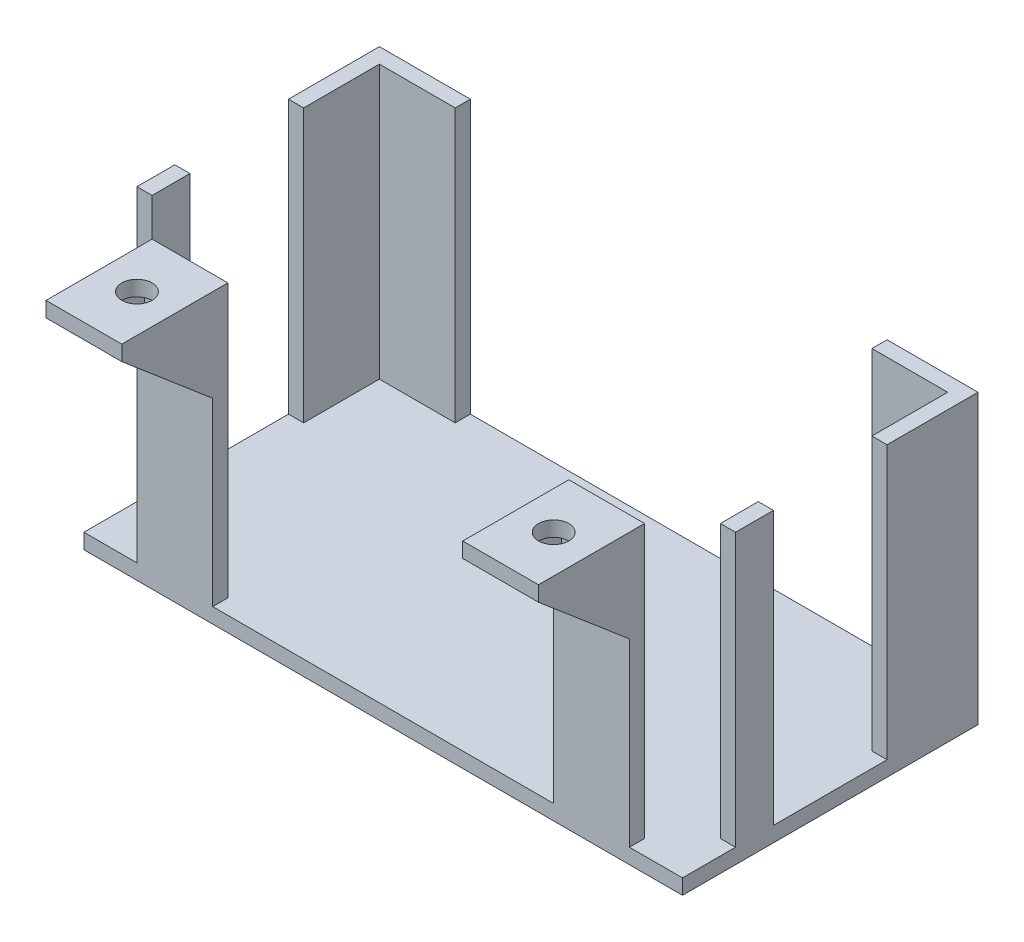
from build123d import *

# Parameters (mm, degrees)
CROQUIS1_W                = 5
CROQUIS1_H                = 2
SALIENTE_EXTRUIR1_DEPTH   = 36
CROQUIS1_W_2              = 2
CROQUIS1_H_2              = 5
SALIENTE_EXTRUIR1_2_DEPTH = 36
SALIENTE_EXTRUIR1_3_DEPTH = 36
SALIENTE_EXTRUIR1_4_DEPTH = 36
SALIENTE_EXTRUIR1_5_DEPTH = 36
CROQUIS2_W                = 79
CROQUIS2_H                = 39
SALIENTE_EXTRUIR2_DEPTH   = 2
CORTAR_EXTRUIR1_DEPTH     = 36
CROQUIS4_W                = 5
CROQUIS4_H                = 2
SALIENTE_EXTRUIR3_DEPTH   = 36
CROQUIS5_W                = 10
CROQUIS5_H                = 2
SALIENTE_EXTRUIR4_DEPTH   = 12
NERVIO1_REACH             = 88.442
CROQUIS8_WALL_W           = 190.62700295
CROQUIS8_WALL_H           = 1
NERVIO2_REACH             = 80.309
CROQUIS9_WALL_W           = 174.36001667
CROQUIS9_WALL_H           = 1
NERVIO3_REACH             = 88.442
CROQUIS10_WALL_W          = 190.62700295
CROQUIS10_WALL_H          = 1
NERVIO4_REACH             = 80.309
CROQUIS11_WALL_W          = 174.36001667
CROQUIS11_WALL_H          = 1
CROQUIS12_R               = 2
CORTAR_EXTRUIR2_DEPTH     = 64.217877218


with BuildPart() as part:
    # Croquis1 → Saliente-Extruir1 (new body)
    with BuildSketch(Plane(origin=(0, 0, 0), x_dir=(1, 0, 0), z_dir=(0, 1, 0))):
        with Locations((30, -18.5)):
            Rectangle(CROQUIS1_W, CROQUIS1_H)
    extrude(amount=SALIENTE_EXTRUIR1_DEPTH)



with BuildPart() as body_2:
    # Croquis1 → Saliente-Extruir1 2 (new body)
    with BuildSketch(Plane(origin=(0, 0, 0), x_dir=(1, 0, 0), z_dir=(0, 1, 0))):
        with Locations((38.5, -10)):
            Rectangle(CROQUIS1_W_2, CROQUIS1_H_2)
    extrude(amount=SALIENTE_EXTRUIR1_2_DEPTH)


with BuildPart() as body_3:
    # Croquis1 → Saliente-Extruir1 3 (new body)
    with BuildSketch(Plane(origin=(0, 0, 0), x_dir=(1, 0, 0), z_dir=(0, 1, 0))):
        Polygon((39.5, 19.5), (27.5, 19.5), (27.5, 17.5), (37.5, 17.5), (37.5, 7.5), (39.5, 7.5), align=None)
    extrude(amount=SALIENTE_EXTRUIR1_3_DEPTH)


with BuildPart() as body_4:
    # Croquis1 → Saliente-Extruir1 4 (new body)
    with BuildSketch(Plane(origin=(0, 0, 0), x_dir=(1, 0, 0), z_dir=(0, 1, 0))):
        Polygon((-39.5, 7.5), (-39.5, 19.5), (-27.5, 19.5), (-27.5, 17.5), (-37.5, 17.5), (-37.5, 7.5), align=None)
    extrude(amount=SALIENTE_EXTRUIR1_4_DEPTH)


with BuildPart() as body_5:
    # Croquis1 → Saliente-Extruir1 5 (new body)
    with BuildSketch(Plane(origin=(0, 0, 0), x_dir=(1, 0, 0), z_dir=(0, 1, 0))):
        Polygon((-39.5, -7.5), (-39.5, -19.5), (-27.5, -19.5), (-27.5, -17.5), (-37.5, -17.5), (-37.5, -7.5), align=None)
    extrude(amount=SALIENTE_EXTRUIR1_5_DEPTH)


with BuildPart() as part_1:
    add(part.part)

    add(body_2.part)  # Saliente-Extruir2 merges body 2

    add(body_3.part)  # Saliente-Extruir2 merges body 3

    add(body_4.part)  # Saliente-Extruir2 merges body 4

    add(body_5.part)  # Saliente-Extruir2 merges body 5
    # Croquis2 → Saliente-Extruir2 (add)
    with BuildSketch(Plane.XZ):
        Rectangle(CROQUIS2_W, CROQUIS2_H)
    extrude(amount=SALIENTE_EXTRUIR2_DEPTH)

    # Croquis3 → Cortar-Extruir1 (cut)
    with BuildSketch(Plane(origin=(0, 36, 0), x_dir=(1, 0, 0), z_dir=(0, 1, 0))):
        Polygon((-32.5, -17.5), (-32.5, -19.5), (-39.5, -19.5), (-39.5, -12.5), (-37.5, -12.5), (-37.5, -17.5), align=None)
    extrude(amount=-CORTAR_EXTRUIR1_DEPTH, mode=Mode.SUBTRACT)

    # Croquis4 → Saliente-Extruir3 (add)
    with BuildSketch(Plane(origin=(0, 0, 0), x_dir=(1, 0, 0), z_dir=(0, 1, 0))):
        with Locations((-25, -18.5)):
            Rectangle(CROQUIS4_W, CROQUIS4_H)
        with Locations((25, -18.5)):
            Rectangle(CROQUIS4_W, CROQUIS4_H)
    extrude(amount=SALIENTE_EXTRUIR3_DEPTH)

    # Croquis5 → Saliente-Extruir4 (add)
    with BuildSketch(Plane.XY.offset(19.5)):
        with Locations((-27.5, 35)):
            Rectangle(CROQUIS5_W, CROQUIS5_H)
        with Locations((27.5, 35)):
            Rectangle(CROQUIS5_W, CROQUIS5_H)
    extrude(amount=SALIENTE_EXTRUIR4_DEPTH)

    # Croquis8 wall → Nervio1 (add, up to next)
    with BuildSketch(Plane(origin=(-32.5, 28.90512554, 25.5), x_dir=(0, -0.647270304875, -0.762260554159), z_dir=(0, -0.762260554159, 0.647270304875)), mode=Mode.PRIVATE) as nervio1_sk1:
        with Locations((0, 0.5)):
            Rectangle(CROQUIS8_WALL_W, CROQUIS8_WALL_H)
    nervio1_tool1 = extrude(nervio1_sk1.sketch, amount=-NERVIO1_REACH, mode=Mode.PRIVATE) - part_1.part
    add(nervio1_tool1.solids().sort_by_distance((-32.5, 28.90512554, 25.5))[0])

    # Croquis9 wall → Nervio2 (add, up to next)
    with BuildSketch(Plane(origin=(-22.5, 28.90512554, 25.5), x_dir=(0, -0.647270304875, -0.762260554159), z_dir=(0, 0.762260554159, -0.647270304875)), mode=Mode.PRIVATE) as nervio2_sk1:
        with Locations((0, 0.5)):
            Rectangle(CROQUIS9_WALL_W, CROQUIS9_WALL_H)
    nervio2_tool1 = extrude(nervio2_sk1.sketch, amount=NERVIO2_REACH, mode=Mode.PRIVATE) - part_1.part
    add(nervio2_tool1.solids().sort_by_distance((-22.5, 28.90512554, 25.5))[0])

    # Croquis10 wall → Nervio3 (add, up to next)
    with BuildSketch(Plane(origin=(32.5, 28.90512554, 25.5), x_dir=(0, -0.647270304875, -0.762260554159), z_dir=(0, 0.762260554159, -0.647270304875)), mode=Mode.PRIVATE) as nervio3_sk1:
        with Locations((0, 0.5)):
            Rectangle(CROQUIS10_WALL_W, CROQUIS10_WALL_H)
    nervio3_tool1 = extrude(nervio3_sk1.sketch, amount=NERVIO3_REACH, mode=Mode.PRIVATE) - part_1.part
    add(nervio3_tool1.solids().sort_by_distance((32.5, 28.90512554, 25.5))[0])

    # Croquis11 wall → Nervio4 (add, up to next)
    with BuildSketch(Plane(origin=(22.5, 28.90512554, 25.5), x_dir=(0, 0.647270304875, 0.762260554159), z_dir=(0, 0.762260554159, -0.647270304875)), mode=Mode.PRIVATE) as nervio4_sk1:
        with Locations((0, 0.5)):
            Rectangle(CROQUIS11_WALL_W, CROQUIS11_WALL_H)
    nervio4_tool1 = extrude(nervio4_sk1.sketch, amount=NERVIO4_REACH, mode=Mode.PRIVATE) - part_1.part
    add(nervio4_tool1.solids().sort_by_distance((22.5, 28.90512554, 25.5))[0])

    # Croquis12 → Cortar-Extruir2 (cut, through all)
    with BuildSketch(Plane(origin=(0, 36, 0), x_dir=(1, 0, 0), z_dir=(0, 1, 0))):
        with Locations(Location((27.5, -24.5, 0), (0, 0, 270))):
            Circle(CROQUIS12_R)
        with Locations(Location((-27.5, -24.5, 0), (0, 0, 270))):
            Circle(CROQUIS12_R)
    extrude(amount=-CORTAR_EXTRUIR2_DEPTH, mode=Mode.SUBTRACT)


solid = part_1.part
